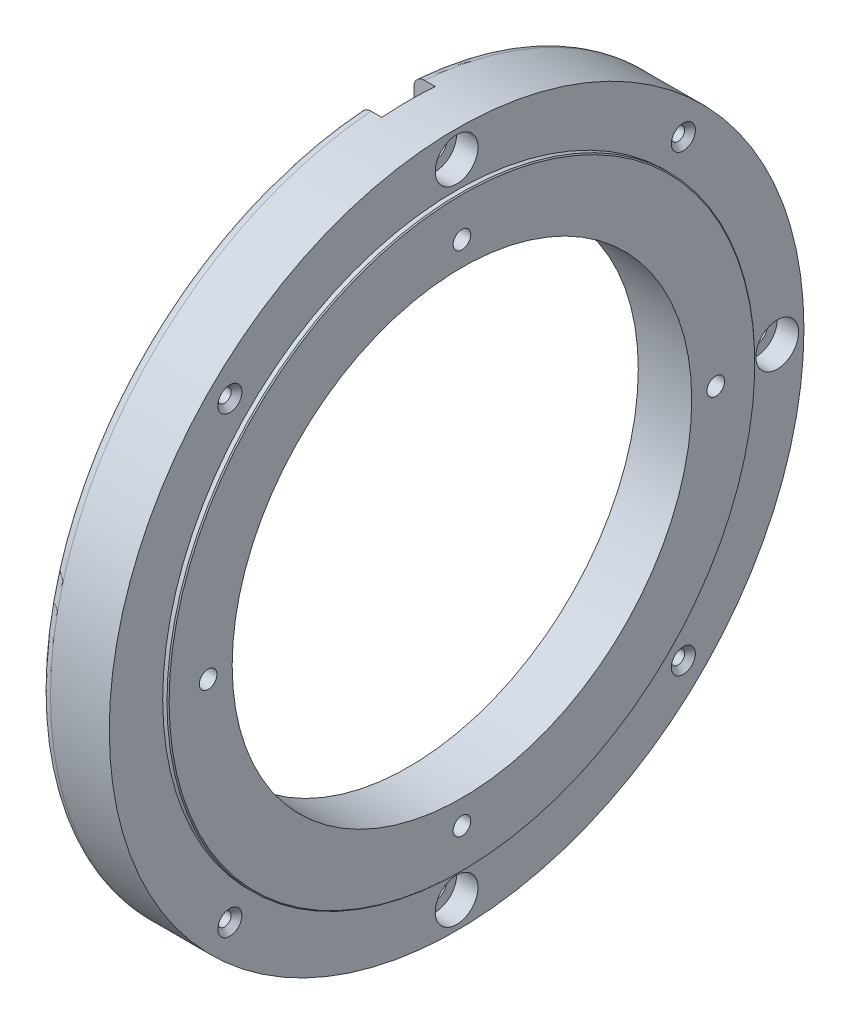
from build123d import *

# Parameters (mm, degrees)
CONG_1_R                                           = 2
CHANFREIN1_SIZE                                    = 0.5
ENL_V_MAT_EXTRU_1_DEPTH                            = 4
TROU_TARAUD_M41_D                                  = 3.3
CHAMBRAGE_POUR_VIS_T_TE_HEXAGONALE_M41_D           = 4.3
CHAMBRAGE_POUR_VIS_T_TE_HEXAGONALE_M41_CBORE_D     = 8
CHAMBRAGE_POUR_VIS_T_TE_HEXAGONALE_M41_CBORE_DEPTH = 5
CHANFREIN2_SIZE                                    = 0.2
TROU_TARAUD_M31_D                                  = 2.5
TROU_TARAUD_M31_CSINK_D                            = 4.5
TROU_TARAUD_M31_CSINK_ANGLE                        = 90


with BuildPart() as part:
    # Esquisse1 → Révolution1 (revolve)
    with BuildSketch(Plane.XY, mode=Mode.PRIVATE) as r_volution1_sk:
        Polygon((0, 55), (0, 65), (13, 65), (13, 55), (14, 55), (14, 43), (4, 43), (4, 55), align=None)
    revolve(r_volution1_sk.sketch.rotate(Axis((0, 0, 0), (1, 0, 0)), 90), axis=Axis((0, 0, 0), (1, 0, 0)))

    # Congé1
    cong_1_edges = [part.edges().sort_by_distance(p)[0] for p in [
        (0, 0, -65),
    ]]
    fillet(cong_1_edges, radius=CONG_1_R)

    # Chanfrein1
    chanfrein1_edges = [part.edges().sort_by_distance(p)[0] for p in [
        (0, 0, -55),
    ]]
    chamfer(chanfrein1_edges, length=CHANFREIN1_SIZE)

    # Esquisse5 → Enlèv. mat.-Extru.1 (cut)
    with BuildSketch(Plane.ZY):
        Polygon((-5, 80), (-5, 5), (-80, 5), (-80, -5), (-5, -5), (-5, -80), (5, -80), (5, -5), (5, 5), (5, 80), align=None)
    extrude(amount=-ENL_V_MAT_EXTRU_1_DEPTH, mode=Mode.SUBTRACT)

    # Trou taraudé M41 (through all)
    with Locations(Plane(origin=(14, 0, 0), x_dir=(0, 0, -1), z_dir=(1, 0, 0))):
        with Locations((0, 47.5), (47.5, 0), (0, -47.5), (-47.5, 0)):
            Hole(TROU_TARAUD_M41_D / 2)

    # Chambrage pour vis à tête hexagonale M41 (through all)
    with Locations(Plane(origin=(14, 0, 0), x_dir=(0, 0, -1), z_dir=(1, 0, 0))):
        with Locations((0, 60), (60, 0), (0, -60)):
            CounterBoreHole(CHAMBRAGE_POUR_VIS_T_TE_HEXAGONALE_M41_D / 2, CHAMBRAGE_POUR_VIS_T_TE_HEXAGONALE_M41_CBORE_D / 2, CHAMBRAGE_POUR_VIS_T_TE_HEXAGONALE_M41_CBORE_DEPTH)

    # Chanfrein2
    chanfrein2_edges = [part.edges().sort_by_distance(p)[0] for p in [
        (14, 0, -55),
    ]]
    chamfer(chanfrein2_edges, length=CHANFREIN2_SIZE)

    # Trou taraudé M31 (through all)
    with Locations(Plane(origin=(13, 0, 0), x_dir=(0, 0, -1), z_dir=(1, 0, 0))):
        with Locations((42.426406871, 42.426406871), (42.426406871, -42.426406871), (-42.426406871, -42.426406871), (-42.426406871, 42.426406871)):
            CounterSinkHole(TROU_TARAUD_M31_D / 2, TROU_TARAUD_M31_CSINK_D / 2, counter_sink_angle=TROU_TARAUD_M31_CSINK_ANGLE)


solid = part.part
